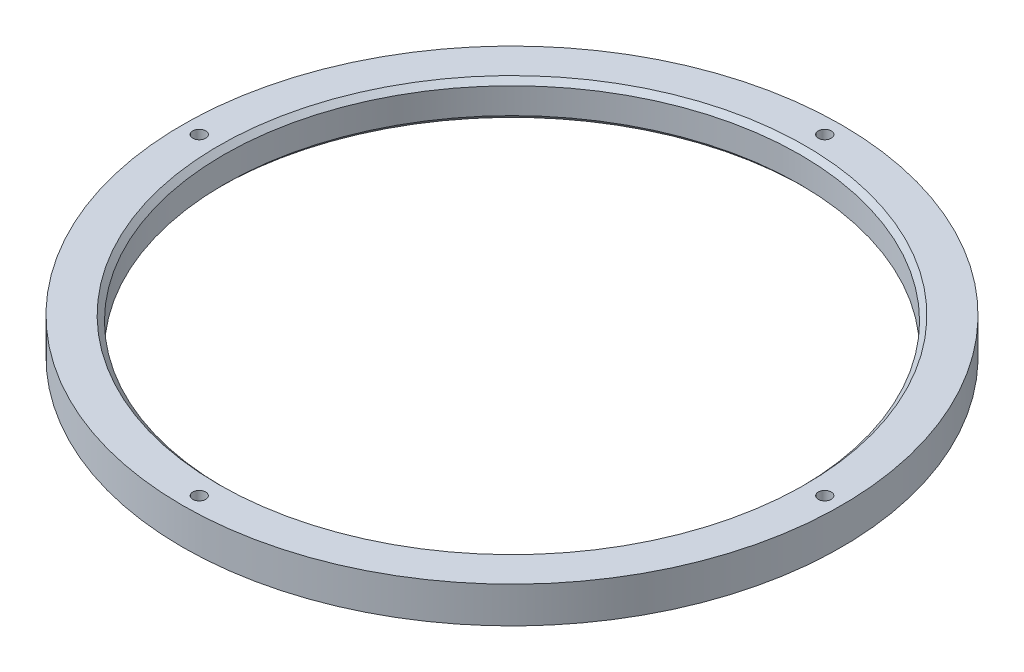
from build123d import *

# Parameters (mm, degrees)
SKETCH1_R           = 127.5
SKETCH1_R_2         = 111.5
SKETCH1_R_3         = 2.5
BOSS_EXTRUDE1_DEPTH = 14
CHAMFER1_SIZE       = 2


with BuildPart() as part:
    # Sketch1 → Boss-Extrude1 (new body)
    with BuildSketch(Plane(origin=(0, 0, 0), x_dir=(1, 0, 0), z_dir=(0, 1, 0))):
        with Locations(Location((0, 0, 0), (0, 0, 270))):
            Circle(SKETCH1_R)
        with Locations(Location((0, 0, 0), (0, 0, 270))):
            Circle(SKETCH1_R_2, mode=Mode.SUBTRACT)
        with Locations(Location((0, 121, 0), (0, 0, 270))):
            Circle(SKETCH1_R_3, mode=Mode.SUBTRACT)
        with Locations(Location((121, 0, 0), (0, 0, 270))):
            Circle(SKETCH1_R_3, mode=Mode.SUBTRACT)
        with Locations(Location((0, -121, 0), (0, 0, 270))):
            Circle(SKETCH1_R_3, mode=Mode.SUBTRACT)
        with Locations(Location((-121, 0, 0), (0, 0, 270))):
            Circle(SKETCH1_R_3, mode=Mode.SUBTRACT)
    extrude(amount=BOSS_EXTRUDE1_DEPTH)

    # Chamfer1
    chamfer1_edges = [part.edges().sort_by_distance(p)[0] for p in [
        (0, 0, -111.5),
        (0, 14, -111.5),
    ]]
    chamfer(chamfer1_edges, length=CHAMFER1_SIZE)


solid = part.part
